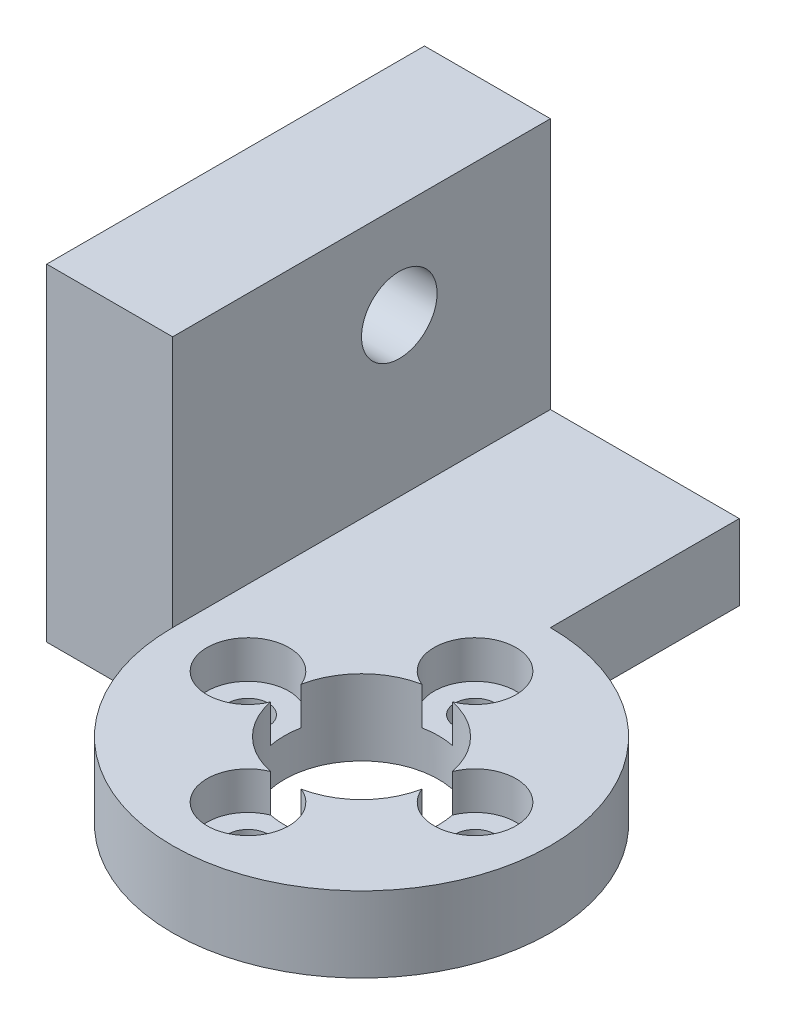
from build123d import *

# Parameters (mm, degrees)
SKETCH1_R                       = 15
BOSS_EXTRUDE1_DEPTH             = 6
CUT_EXTRUDE1_REACH              = 24.045
SKETCH2_R                       = 6.125
CBORE_FOR_M3_SHCS2_D            = 3.2
CBORE_FOR_M3_SHCS2_CBORE_D      = 6.5
CBORE_FOR_M3_SHCS2_CBORE_DEPTH  = 3
CIRPATTERN1_COUNT               = 4
BOSS_EXTRUDE2_REACH             = 24.045
BOSS_EXTRUDE2_DIRECTION_2_DEPTH = 20
CUT_EXTRUDE2_START              = -25
SKETCH7_W                       = 15
SKETCH7_H                       = 20
CUT_EXTRUDE2_DEPTH              = 15
BOSS_EXTRUDE3_DEPTH             = 15
CUT_EXTRUDE3_REACH              = 51.759
SKETCH8_R                       = 3


with BuildPart() as part:
    # Sketch1 → Boss-Extrude1 (new body)
    with BuildSketch(Plane(origin=(0, 0, 0), x_dir=(1, 0, 0), z_dir=(0, 1, 0))):
        with Locations(Location((0, 0, 0), (0, 0, 270))):
            Circle(SKETCH1_R)
    extrude(amount=BOSS_EXTRUDE1_DEPTH)

    # Sketch2 → Cut-Extrude1 (cut, up to next)
    with BuildSketch(Plane(origin=(0, 6, 0), x_dir=(1, 0, 0), z_dir=(0, 1, 0)), mode=Mode.PRIVATE) as cut_extrude1_sk1:
        with Locations(Location((0, 0, 0), (0, 0, 270))):
            Circle(SKETCH2_R)
    cut_extrude1_tool1 = extrude(cut_extrude1_sk1.sketch, amount=-CUT_EXTRUDE1_REACH, mode=Mode.PRIVATE) & part.part
    add(cut_extrude1_tool1.solids().sort_by_distance((0, 6, 0))[0], mode=Mode.SUBTRACT)

    # CBORE for M3 SHCS2 (through all)
    with Locations(Plane(origin=(0, 6, 0), x_dir=(1, 0, 0), z_dir=(0, 1, 0))):
        with Locations((0, 9.017)):
            cbore_for_m3_shcs2 = CounterBoreHole(CBORE_FOR_M3_SHCS2_D / 2, CBORE_FOR_M3_SHCS2_CBORE_D / 2, CBORE_FOR_M3_SHCS2_CBORE_DEPTH)

    # CirPattern1: CBORE for M3 SHCS2 ×4 about axis
    cirpattern1_axis = Axis((0, 0, 0), (0, 1, 0))
    for i in range(1, CIRPATTERN1_COUNT):
        add(cbore_for_m3_shcs2.rotate(cirpattern1_axis, i * 360 / CIRPATTERN1_COUNT), mode=Mode.SUBTRACT)

    # Boss-Extrude2: up to this face of the body (flat: up to its plane)
    boss_extrude2_end = Plane(part.part.faces().sort_by_distance((0, 0, -14.575735931))[0])
    # Sketch6 → Boss-Extrude2 (add, up to the picked face)
    with BuildSketch(Plane(origin=(0, 6, 0), x_dir=(1, 0, 0), z_dir=(0, 1, 0)), mode=Mode.PRIVATE) as boss_extrude2_sk1:
        with BuildLine():
            Line((-25, 0), (-25, 15))
            Line((-25, 15), (0, 15))
            ThreePointArc((0, 15), (-10.606601718, 10.606601718), (-15, 0))
            Line((-15, 0), (-25, 0))
        make_face()
    boss_extrude2_tool1 = split(extrude(boss_extrude2_sk1.sketch, amount=-BOSS_EXTRUDE2_REACH, mode=Mode.PRIVATE), bisect_by=boss_extrude2_end, keep=Keep.BOTH, mode=Mode.PRIVATE)
    add(boss_extrude2_tool1.solids().sort_by(Axis((-17.966526, 6, -8.51046), (0, -1, 0)))[0])

    # Sketch6 → Boss-Extrude2 direction 2 (add)
    with BuildSketch(Plane(origin=(0, 6, 0), x_dir=(1, 0, 0), z_dir=(0, 1, 0))):
        with BuildLine():
            Line((-25, 0), (-25, 15))
            Line((-25, 15), (0, 15))
            ThreePointArc((0, 15), (-10.606601718, 10.606601718), (-15, 0))
            Line((-15, 0), (-25, 0))
        make_face()
    extrude(amount=BOSS_EXTRUDE2_DIRECTION_2_DEPTH)

    # Sketch7 → Cut-Extrude2 (cut)
    with BuildSketch(Plane.ZY.offset(25).offset(CUT_EXTRUDE2_START)):
        with Locations((-7.5, 16)):
            Rectangle(SKETCH7_W, SKETCH7_H)
    extrude(amount=CUT_EXTRUDE2_DEPTH, mode=Mode.SUBTRACT)

    # Sketch9 → Boss-Extrude3 (add)
    with BuildSketch(Plane(origin=(0, 0, -15), x_dir=(-1, 0, 0), z_dir=(0, 0, -1))):
        Polygon((15, 26), (15, 6), (0, 6), (0, 0), (25, 0), (25, 26), align=None)
    extrude(amount=BOSS_EXTRUDE3_DEPTH)

    # Sketch8 → Cut-Extrude3 (cut, up to next)
    with BuildSketch(Plane(origin=(-15, 0, 0), x_dir=(0, 0, -1), z_dir=(1, 0, 0)), mode=Mode.PRIVATE) as cut_extrude3_sk1:
        with Locations((18, 18.5)):
            Circle(SKETCH8_R)
    cut_extrude3_tool1 = extrude(cut_extrude3_sk1.sketch, amount=-CUT_EXTRUDE3_REACH, mode=Mode.PRIVATE) & part.part
    add(cut_extrude3_tool1.solids().sort_by_distance((-15, 18.5, -18))[0], mode=Mode.SUBTRACT)


solid = part.part
